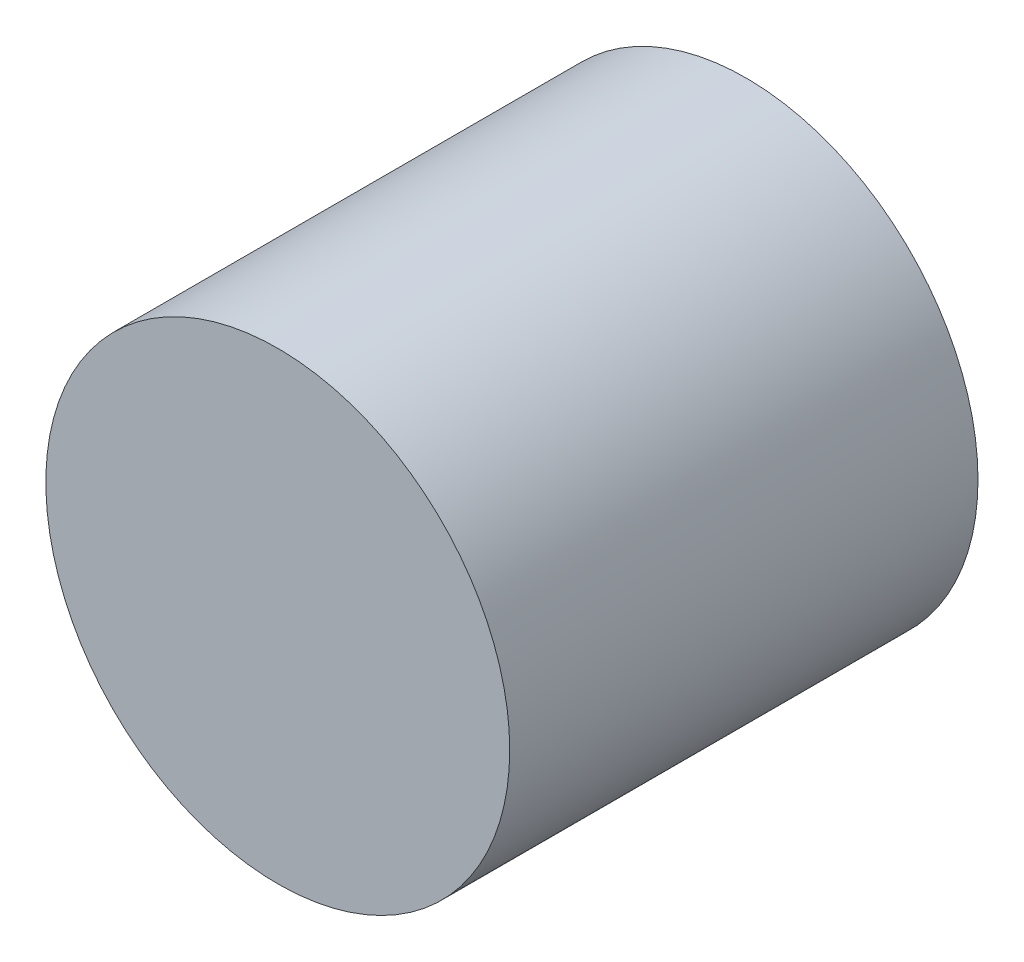
from build123d import *

# Parameters (mm, degrees)
SKETCH1_R           = 7.925
BOSS_EXTRUDE1_DEPTH = 16


with BuildPart() as part:
    # Sketch1 → Boss-Extrude1 (new body)
    with BuildSketch(Plane.XY):
        Circle(SKETCH1_R)
    extrude(amount=BOSS_EXTRUDE1_DEPTH)


solid = part.part
